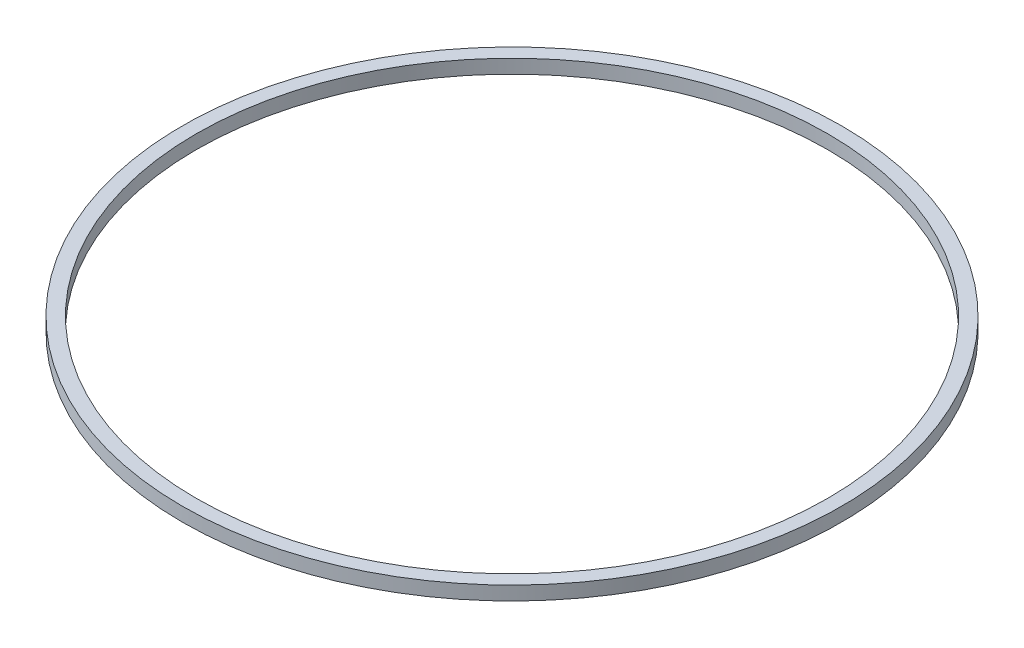
from build123d import *

# Parameters (mm, degrees)
SKETCH1_W = 2.121320344
SKETCH1_H = 2.121320344


with BuildPart() as part:
    # Sketch1 → Revolve1 (revolve)
    with BuildSketch(Plane.XY, mode=Mode.PRIVATE) as revolve1_sk:
        with Locations((-49.600660172, 1.060660172)):
            Rectangle(SKETCH1_W, SKETCH1_H)
    revolve(revolve1_sk.sketch.rotate(Axis((0, 0, 0), (0, 1, 0)), 270), axis=Axis((0, 0, 0), (0, 1, 0)))


solid = part.part
